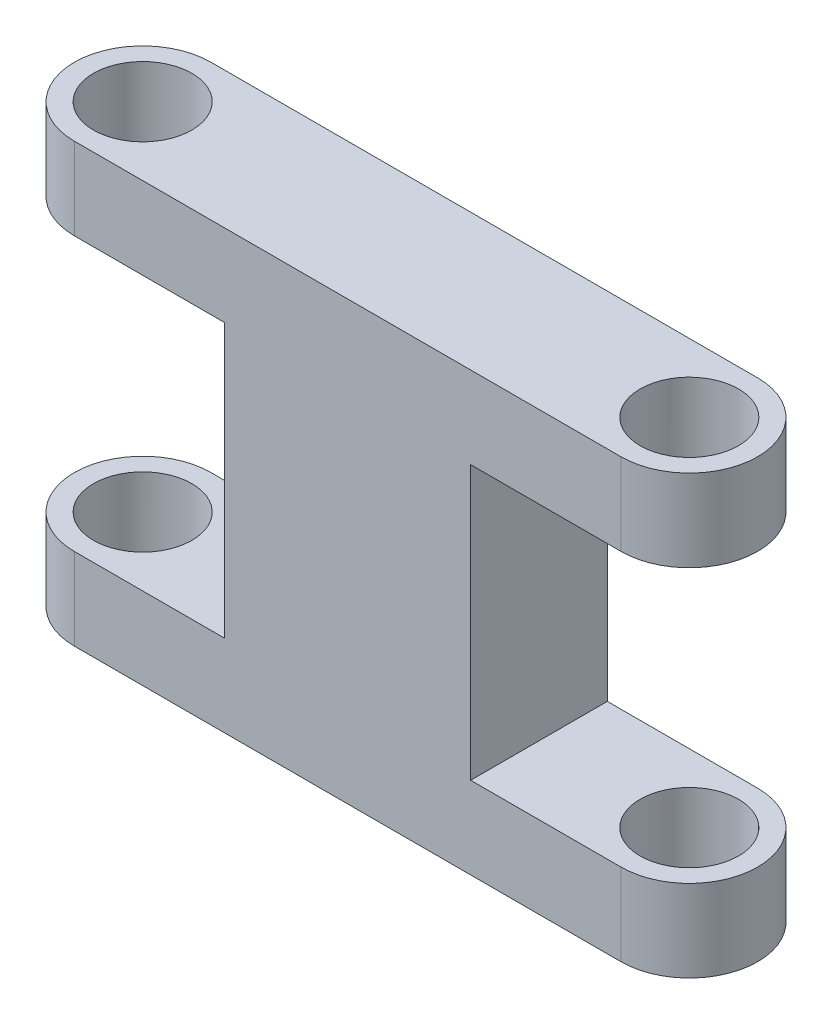
from build123d import *

# Parameters (mm, degrees)
SKETCH_1_R          = 2.5
SKETCH_1_R_2        = 1.8
EXTRUDE_1_DEPTH     = 16
CUT_EXTRUDE_1_REACH = 33.357
SKETCH_2_W          = 8
SKETCH_2_H          = 10


with BuildPart() as part:
    # 草图1 → 凸台-拉伸1 (new body)
    # profile 1 of 3: a face of its own
    with BuildSketch(Plane(origin=(0, 0, 0), x_dir=(1, 0, 0), z_dir=(0, 1, 0))):
        with BuildLine():
            Line((24, -1.5), (4, -1.5))
            ThreePointArc((4, -1.5), (5.767766953, -2.232233047), (6.5, -4))
            ThreePointArc((6.5, -4), (5.767766953, -5.767766953), (4, -6.5))
            Line((4, -6.5), (24, -6.5))
            ThreePointArc((24, -6.5), (21.5, -4), (24, -1.5))
        make_face()
    # profile 2 of 3: a face of its own
    with BuildSketch(Plane(origin=(0, 0, 0), x_dir=(1, 0, 0), z_dir=(0, 1, 0))):
        with Locations((4, -4)):
            Circle(SKETCH_1_R)
        with Locations(Location((4, -4, 0), (0, 0, 270))):
            Circle(SKETCH_1_R_2, mode=Mode.SUBTRACT)
    # profile 3 of 3: a face of its own
    with BuildSketch(Plane(origin=(0, 0, 0), x_dir=(1, 0, 0), z_dir=(0, 1, 0))):
        with Locations((24, -4)):
            Circle(SKETCH_1_R)
        with Locations(Location((24, -4, 0), (0, 0, 270))):
            Circle(SKETCH_1_R_2, mode=Mode.SUBTRACT)
    extrude(amount=EXTRUDE_1_DEPTH)

    # 草图2 → 切除-拉伸1 (cut, up to next)
    with BuildSketch(Plane.XY.offset(6.5), mode=Mode.PRIVATE) as cut_extrude_1_sk1:
        with Locations((22.5, 8)):
            Rectangle(SKETCH_2_W, SKETCH_2_H)
    cut_extrude_1_tool1 = extrude(cut_extrude_1_sk1.sketch, amount=-CUT_EXTRUDE_1_REACH, mode=Mode.PRIVATE) & part.part
    # 草图2 → 切除-拉伸1 (cut, up to next)
    with BuildSketch(Plane.XY.offset(6.5), mode=Mode.PRIVATE) as cut_extrude_1_sk2:
        with Locations((5.5, 8)):
            Rectangle(SKETCH_2_W, SKETCH_2_H)
    cut_extrude_1_tool2 = extrude(cut_extrude_1_sk2.sketch, amount=-CUT_EXTRUDE_1_REACH, mode=Mode.PRIVATE) & part.part
    add(cut_extrude_1_tool1.solids().sort_by_distance((22.5, 8, 6.5))[0], mode=Mode.SUBTRACT)
    add(cut_extrude_1_tool2.solids().sort_by_distance((5.5, 8, 6.5))[0], mode=Mode.SUBTRACT)


solid = part.part
